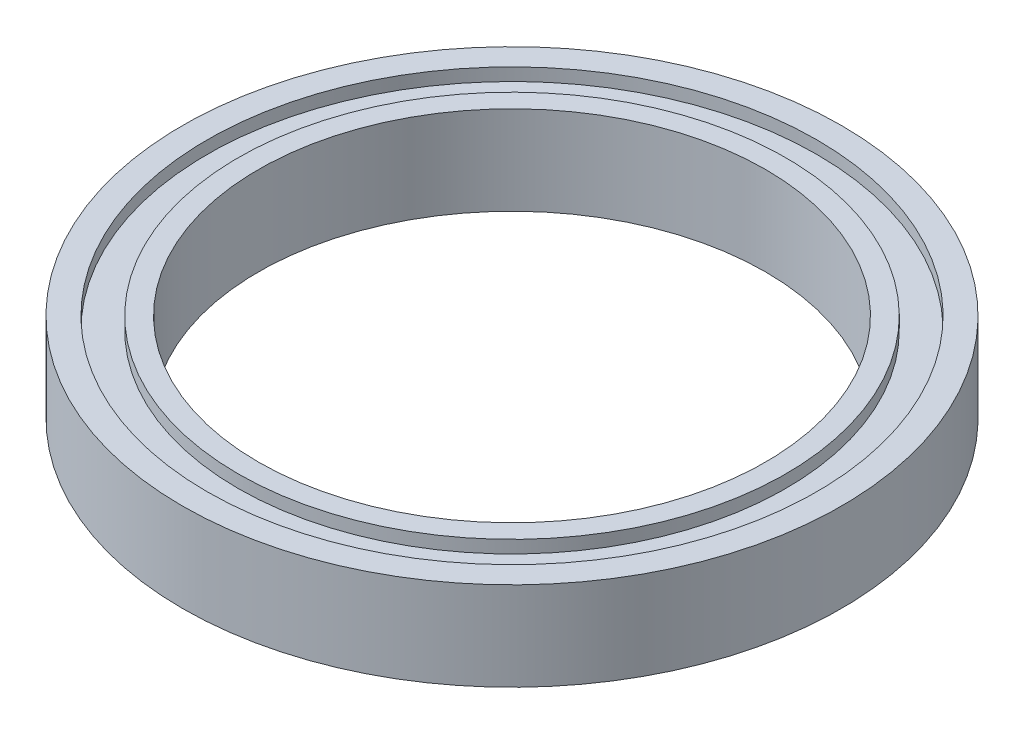
from build123d import *


with BuildPart() as part:
    # 草图2 → 旋转1 (revolve)
    with BuildSketch(Plane.XY, mode=Mode.PRIVATE) as revolve_1_sk:
        Polygon((26, -3.5), (26, 3.5), (24.05, 3.5), (24.05, 2.5), (21.605, 2.5), (21.605, 3.5), (20, 3.5), (20, -3.5), (21.605, -3.5), (21.605, -2.5), (24.05, -2.5), (24.05, -3.5), align=None)
    revolve(revolve_1_sk.sketch.rotate(Axis((0, 53.940013569, 0), (0, -1, 0)), 90), axis=Axis((0, 53.940013569, 0), (0, -1, 0)))


solid = part.part
